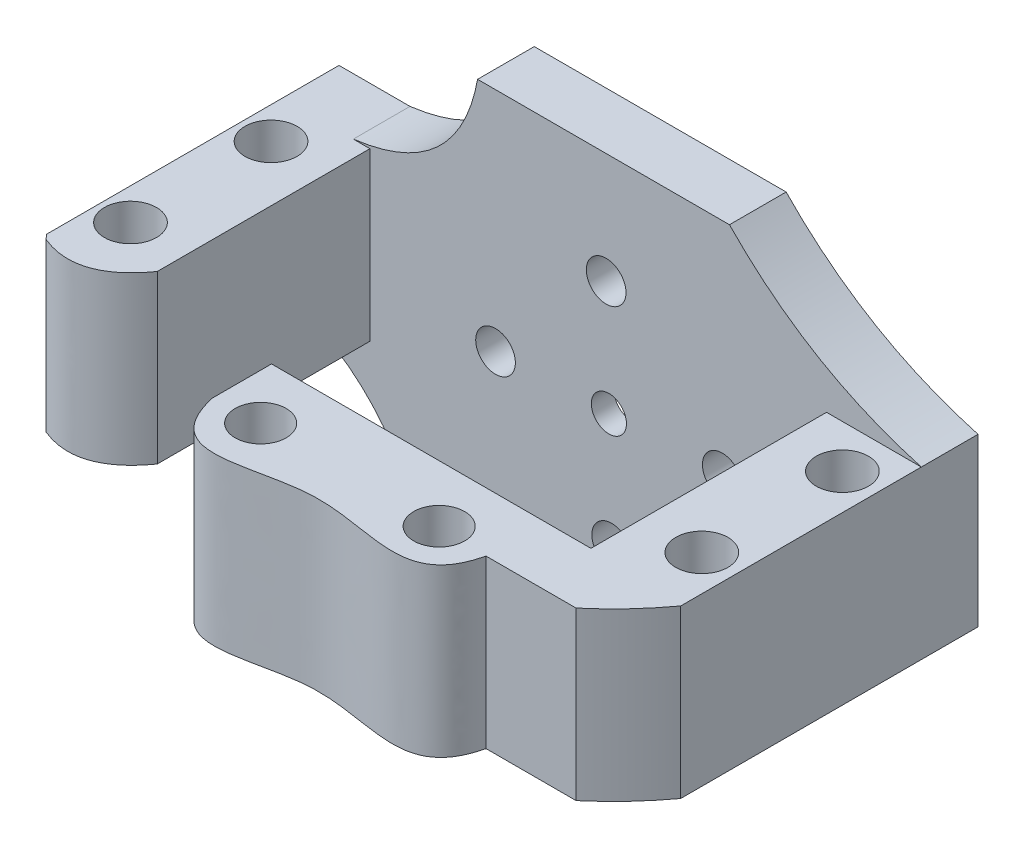
from build123d import *

# Parameters (mm, degrees)
BOSS_EXTRUDE1_DEPTH      = 2
BOSS_EXTRUDE1_DEPTH_BACK = 3
SKETCH1_W                = 56.68892319
SKETCH1_H                = 35.065129922
BOSS_EXTRUDE2_DEPTH      = 26
BOSS_EXTRUDE2_DEPTH_BACK = 5
SKETCH2_W                = 9
SKETCH2_H                = 14.710997498
SKETCH5_R                = 5.097736242
BOSS_EXTRUDE4_DEPTH      = 2
SKETCH6_R                = 1.55
CUT_EXTRUDE2_DEPTH       = 12
SKETCH9_R                = 2.3
CUT_EXTRUDE3_DEPTH       = 50.872623649
SKETCH13_W               = 7.608886802
SKETCH13_H               = 17.558293241
CUT_EXTRUDE4_DEPTH       = 54.293517107
CUT_EXTRUDE6_DEPTH       = 50.872623649
CUT_EXTRUDE7_DEPTH       = 10
CUT_EXTRUDE7_DEPTH_BACK  = 50.999496602
SKETCH17_W               = 7.162243751
SKETCH17_H               = 32.627999311
SKETCH17_W_2             = 7.157690474
SKETCH17_H_2             = 31.051745439
CUT_EXTRUDE9_DEPTH       = 2.5
SKETCH24_R               = 1.75
CUT_EXTRUDE10_DEPTH      = 52.478229038
CUT_EXTRUDE12_DEPTH      = 10
BOSS_EXTRUDE5_DEPTH      = 40.277622666
BOSS_EXTRUDE6_DEPTH      = 14.710997498
SKETCH30_R               = 2.25
CUT_EXTRUDE13_DEPTH      = 52.916046991
CUT_EXTRUDE14_DEPTH      = 52.916046991


with BuildPart() as part:
    # Sketch1 → Boss-Extrude1 (new, two sides: drawn at the far end of the back side and taken through both)
    with BuildSketch(Plane.XY.offset(-BOSS_EXTRUDE1_DEPTH_BACK)):
        with Locations((4.039813673, 10.556877227)):
            Rectangle(SKETCH1_W, SKETCH1_H)
        Polygon((1.923198111, 7.878945264), (2.078602096, 7.815714119), (1.958456546, 7.698608939), (2.117524193, 7.645260463), (2.004968818, 7.520842362), (2.16707236, 7.477587097), (2.062551364, 7.346347096), (2.227051052, 7.313355751), (2.130976932, 7.175811795), (2.297223562, 7.153214572), (2.209975479, 7.009909484), (2.37731295, 6.997795563), (2.299235232, 6.849294902), (2.46700314, 6.847712092), (2.398403924, 6.694601923), (2.565940166, 6.70355647), (2.507090183, 6.546441049), (2.67373357, 6.565897614), (2.624865072, 6.405397003), (2.789957938, 6.4352788), (2.751263788, 6.272026422), (2.914154587, 6.312215521), (2.885787493, 6.146855658), (3.04583337, 6.197193451), (3.027905283, 6.030378703), (3.184474611, 6.09066653), (3.177056286, 5.923055239), (3.329531155, 5.993055171), (3.332651868, 5.825308823), (3.480430532, 5.904744602), (3.494077967, 5.737525214), (3.636577209, 5.826083344), (3.660697507, 5.660050854), (3.797354948, 5.757381836), (3.831852916, 5.5931915), (3.962129232, 5.698911213), (4.006868723, 5.537211015), (4.130249772, 5.650902232), (4.185054219, 5.492330327), (4.301053074, 5.613544361), (4.36570619, 5.458726562), (4.473865055, 5.586985036), (4.548111682, 5.436532337), (4.648003705, 5.571329073), (4.731550826, 5.425835242), (4.822781777, 5.56663826), (4.915299671, 5.426677496), (4.997509504, 5.57293111), (5.098633044, 5.439055772), (5.171497314, 5.590182786), (5.280827412, 5.462921221), (5.344058557, 5.618325206), (5.461163737, 5.498179655), (5.514512213, 5.657247303), (5.638930314, 5.544691927), (5.682185579, 5.706795469), (5.81342558, 5.602274473), (5.846416925, 5.766774162), (5.983960881, 5.670700042), (6.006558104, 5.836946671), (6.149863192, 5.749698588), (6.161977113, 5.917036059), (6.310477774, 5.838958341), (6.312060584, 6.00672625), (6.465170753, 5.938127034), (6.456216206, 6.105663276), (6.613331627, 6.046813292), (6.593875062, 6.213456679), (6.754375673, 6.164588181), (6.724493876, 6.329681047), (6.887746254, 6.290986897), (6.847557155, 6.453877697), (7.012917018, 6.425510602), (6.962579225, 6.58555648), (7.129393973, 6.567628393), (7.069106146, 6.72419772), (7.236717437, 6.716779395), (7.166717505, 6.869254264), (7.334463853, 6.872374978), (7.255028074, 7.020153641), (7.422247462, 7.033801076), (7.333689332, 7.176300318), (7.499721822, 7.200420616), (7.40239084, 7.337078057), (7.566581176, 7.371576025), (7.460861463, 7.501852341), (7.622561661, 7.546591832), (7.508870444, 7.669972882), (7.667442349, 7.724777329), (7.546228315, 7.840776184), (7.701046114, 7.905429299), (7.57278764, 8.013588164), (7.723240339, 8.087834791), (7.588443603, 8.187726814), (7.733937434, 8.271273935), (7.593134416, 8.362504887), (7.733095181, 8.45502278), (7.586841566, 8.537232613), (7.720716904, 8.638356153), (7.56958989, 8.711220423), (7.696851455, 8.820550521), (7.54144747, 8.883781667), (7.661593021, 9.000886846), (7.502525373, 9.054235323), (7.615080749, 9.178653423), (7.452977207, 9.221908688), (7.557498203, 9.353148689), (7.392998514, 9.386140034), (7.489072634, 9.52368399), (7.322826005, 9.546281213), (7.410074088, 9.689586302), (7.242736617, 9.701700222), (7.320814335, 9.850200883), (7.153046427, 9.851783693), (7.221645642, 10.004893862), (7.0541094, 9.995939315), (7.112959384, 10.153054737), (6.946315997, 10.133598171), (6.995184495, 10.294098782), (6.830091629, 10.264216985), (6.868785779, 10.427469364), (6.705894979, 10.387280265), (6.734262074, 10.552640127), (6.574216196, 10.502302334), (6.592144283, 10.669117082), (6.435574956, 10.608829255), (6.442993281, 10.776440546), (6.290518412, 10.706440614), (6.287397698, 10.874186963), (6.139619035, 10.794751183), (6.1259716, 10.961970572), (5.983472358, 10.873412442), (5.95935206, 11.039444931), (5.822694619, 10.942113949), (5.788196651, 11.106304285), (5.657920335, 11.000584572), (5.613180844, 11.162284771), (5.489799794, 11.048593553), (5.434995347, 11.207165458), (5.318996492, 11.085951424), (5.254343377, 11.240769224), (5.146184512, 11.11251075), (5.071937885, 11.262963449), (4.972045862, 11.128166712), (4.888498741, 11.273660543), (4.797267789, 11.132857525), (4.704749896, 11.27281829), (4.622540063, 11.126564676), (4.521416523, 11.260440013), (4.448552253, 11.109312999), (4.339222155, 11.236574565), (4.275991009, 11.08117058), (4.15888583, 11.20131613), (4.105537353, 11.042248483), (3.981119253, 11.154803858), (3.937863988, 10.992700316), (3.806623987, 11.097221312), (3.773632642, 10.932721624), (3.636088686, 11.028795744), (3.613491463, 10.862549114), (3.470186374, 10.949797197), (3.458072454, 10.782459726), (3.309571793, 10.860537444), (3.307988983, 10.692769536), (3.154878814, 10.761368752), (3.163833361, 10.59383251), (3.006717939, 10.652682493), (3.026174505, 10.486039107), (2.865673894, 10.534907604), (2.895555691, 10.369814738), (2.732303312, 10.408508888), (2.772492411, 10.245618089), (2.607132549, 10.273985183), (2.657470342, 10.113939306), (2.490655594, 10.131867393), (2.550943421, 9.975298065), (2.38333213, 9.98271639), (2.453332062, 9.830241521), (2.285585713, 9.827120808), (2.365021493, 9.679342144), (2.197802104, 9.665694709), (2.286360234, 9.523195467), (2.120327745, 9.499075169), (2.217658727, 9.362417728), (2.053468391, 9.32791976), (2.159188104, 9.197643444), (1.997487905, 9.152903953), (2.111179123, 9.029522904), (1.952607218, 8.974718457), (2.073821252, 8.858719602), (1.919003452, 8.794066486), (2.047261926, 8.685907621), (1.896809227, 8.611660994), (2.031605964, 8.511768972), (1.886112133, 8.42822185), (2.026915151, 8.336990899), (1.886954386, 8.244473005), (2.033208, 8.162263172), (1.899332663, 8.061139632), (2.050459677, 7.988275362), align=None, mode=Mode.SUBTRACT)
    extrude(amount=BOSS_EXTRUDE1_DEPTH + BOSS_EXTRUDE1_DEPTH_BACK)

    # Sketch2 → Boss-Extrude2 (add, two sides: drawn at the far end of the back side and taken through both)
    with BuildSketch(Plane.XY.offset(2).offset(-BOSS_EXTRUDE2_DEPTH_BACK)):
        Polygon((-16.259715354, 18.039656454), (-16.259715354, 3.328658954), (-25.535246375, 3.328658954), (-25.535246375, 18.039656454), (-18.903134034, 18.039656454), align=None)
        with Locations((28.517907312, 10.684157709)):
            Rectangle(SKETCH2_W, SKETCH2_H)
    extrude(amount=BOSS_EXTRUDE2_DEPTH + BOSS_EXTRUDE2_DEPTH_BACK)

    # Sketch5 → Boss-Extrude4 (add)
    with BuildSketch(Plane.XY.offset(2)):
        with Locations((5.492810563, 7.427794851)):
            Circle(SKETCH5_R)
    extrude(amount=-BOSS_EXTRUDE4_DEPTH)

    # Sketch6 → Cut-Extrude2 (cut)
    with BuildSketch(Plane(origin=(0, 0, -3), x_dir=(-1, 0, 0), z_dir=(0, 0, -1))):
        with Locations(Location((-4.82042515, 8.33646598, 0), (0, 0, 180))):
            Circle(SKETCH6_R)
    extrude(amount=-CUT_EXTRUDE2_DEPTH, mode=Mode.SUBTRACT)

    # Sketch9 → Cut-Extrude3 (cut, through all)
    with BuildSketch(Plane.XZ.offset(-3.328658954)):
        with Locations(Location((-21.182092688, 18.2, 0), (0, 0, 270))):
            Circle(SKETCH9_R)
        with Locations(Location((-21.182092688, 5.8, 0), (0, 0, 270))):
            Circle(SKETCH9_R)
        with Locations(Location((29.217907312, 5.8, 0), (0, 0, 270))):
            Circle(SKETCH9_R)
        with Locations(Location((29.217907312, 18.2, 0), (0, 0, 270))):
            Circle(SKETCH9_R)
    extrude(amount=-CUT_EXTRUDE3_DEPTH, mode=Mode.SUBTRACT)

    # Sketch13 → Cut-Extrude4 (cut, through all)
    with BuildSketch(Plane.XY.offset(28)):
        with Locations((-21.527123777, 26.818803075)):
            Rectangle(SKETCH13_W, SKETCH13_H)
    extrude(amount=-CUT_EXTRUDE4_DEPTH, mode=Mode.SUBTRACT)

    # Sketch16 → Cut-Extrude6 (cut, through all)
    with BuildSketch(Plane.XZ.offset(-3.328658954)):
        with BuildLine():
            Line((-26.354419383, 19.379902699), (-27.787251442, 28.497924892))
            Line((-27.787251442, 28.497924892), (-17.849791636, 28))
            add(Edge.make_bspline(
                [(-17.849791636, 28), (-23.252097772, 24.763584197), (-26.354419383, 19.379902699)],
                knots=[0, 0, 0, 1, 1, 1], degree=2))
        make_face()
        with BuildLine():
            Line((34.733992228, 19.379902699), (34.733992228, 30.066085519))
            Line((34.733992228, 30.066085519), (27.925980754, 28))
            add(Edge.make_bspline(
                [(27.925980754, 28), (32.208635207, 24.359976547), (34.733992228, 19.379902699)],
                knots=[0, 0, 0, 1, 1, 1], degree=2))
        make_face()
    extrude(amount=-CUT_EXTRUDE6_DEPTH, mode=Mode.SUBTRACT)

    # Sketch17 → Cut-Extrude7 (cut, two sides: drawn at the far end of the back side and taken through both)
    with BuildSketch(Plane(origin=(0, 18.039656458, 0), x_dir=(1, 0, 0), z_dir=(0, 1, 0)).offset(-CUT_EXTRUDE7_DEPTH_BACK)):
        with Locations((35.960804817, -11.620676388)):
            Rectangle(SKETCH17_W, SKETCH17_H)
        with Locations((-27.56606756, -9.811105837)):
            Rectangle(SKETCH17_W_2, SKETCH17_H_2)
    extrude(amount=CUT_EXTRUDE7_DEPTH + CUT_EXTRUDE7_DEPTH_BACK, mode=Mode.SUBTRACT)

    # Sketch23 → Cut-Extrude9 (cut)
    with BuildSketch(Plane(origin=(0, 0, -3), x_dir=(-1, 0, 0), z_dir=(0, 0, -1))):
        with BuildLine():
            ThreePointArc((0.924137497, 12.33646598), (0.129322319, 13.286213449), (-0.82042515, 14.081028627))
            add(Edge.make_bspline(
                [(-4.82042515, 26.33646598), (-1.27643089, 26.709624798), (-1.432488287, 20.670941026), (-0.502680663, 16.534821019), (-0.82042515, 14.081028627)],
                knots=[0, 0, 0, 0, 0.519506154, 1, 1, 1, 1], degree=3))
            add(Edge.make_bspline(
                [(-4.82042515, 26.33646598), (-8.364419409, 26.709624798), (-8.208362012, 20.670941026), (-9.138169637, 16.534821019), (-8.82042515, 14.081028627)],
                knots=[0, 0, 0, 0, 0.519506154, 1, 1, 1, 1], degree=3))
            ThreePointArc((-8.82042515, 14.081028627), (-9.770172618, 13.286213449), (-10.564987796, 12.33646598))
            add(Edge.make_bspline(
                [(-22.82042515, 8.33646598), (-23.193583967, 11.88046024), (-17.154900196, 11.724402843), (-13.018780189, 12.654210467), (-10.564987796, 12.33646598)],
                knots=[0, 0, 0, 0, 0.519506154, 1, 1, 1, 1], degree=3))
            add(Edge.make_bspline(
                [(-22.82042515, 8.33646598), (-23.193583967, 4.792471721), (-17.154900196, 4.948529118), (-13.018780189, 4.018721493), (-10.564987796, 4.33646598)],
                knots=[0, 0, 0, 0, 0.519506154, 1, 1, 1, 1], degree=3))
            ThreePointArc((-10.564987796, 4.33646598), (-9.770172618, 3.386718512), (-8.82042515, 2.591903334))
            add(Edge.make_bspline(
                [(-4.82042515, -9.66353402), (-8.364419409, -10.036692837), (-8.208362012, -3.998009066), (-9.138169637, 0.138110942), (-8.82042515, 2.591903334)],
                knots=[0, 0, 0, 0, 0.519506154, 1, 1, 1, 1], degree=3))
            add(Edge.make_bspline(
                [(-4.82042515, -9.66353402), (-1.27643089, -10.036692837), (-1.432488287, -3.998009066), (-0.502680663, 0.138110942), (-0.82042515, 2.591903334)],
                knots=[0, 0, 0, 0, 0.519506154, 1, 1, 1, 1], degree=3))
            ThreePointArc((-0.82042515, 2.591903334), (0.129322319, 3.386718512), (0.924137497, 4.33646598))
            add(Edge.make_bspline(
                [(13.17957485, 8.33646598), (13.552733668, 4.792471721), (7.514049896, 4.948529118), (3.377929889, 4.018721493), (0.924137497, 4.33646598)],
                knots=[0, 0, 0, 0, 0.519506154, 1, 1, 1, 1], degree=3))
            add(Edge.make_bspline(
                [(13.17957485, 8.33646598), (13.552733668, 11.88046024), (7.514049896, 11.724402843), (3.377929889, 12.654210467), (0.924137497, 12.33646598)],
                knots=[0, 0, 0, 0, 0.519506154, 1, 1, 1, 1], degree=3))
        make_face()
    extrude(amount=-CUT_EXTRUDE9_DEPTH, mode=Mode.SUBTRACT)

    # Sketch24 → Cut-Extrude10 (cut, through all)
    with BuildSketch(Plane(origin=(0, 0, -0.5), x_dir=(-1, 0, 0), z_dir=(0, 0, -1))):
        with Locations((5.17957485, 8.09434948)):
            Circle(SKETCH24_R)
        with Locations((-5.06254165, -1.66353402)):
            Circle(SKETCH24_R)
        with Locations((-14.82042515, 8.578582481)):
            Circle(SKETCH24_R)
        with Locations((-4.578308649, 18.33646598)):
            Circle(SKETCH24_R)
    extrude(amount=-CUT_EXTRUDE10_DEPTH, mode=Mode.SUBTRACT)

    # Sketch27 → Cut-Extrude12 (cut)
    with BuildSketch(Plane(origin=(0, 0, -3), x_dir=(-1, 0, 0), z_dir=(0, 0, -1))):
        with BuildLine():
            Line((23.987222323, -6.975687734), (23.987222323, 3.328658954))
            add(Edge.make_bspline(
                [(23.987222323, 3.328658954), (15.98825926, 1.074909733), (12.528917408, -6.975687734)],
                knots=[0, 0, 0, 1, 1, 1], degree=2))
            Line((12.528917408, -6.975687734), (23.987222323, -6.975687734))
        make_face()
        with BuildLine():
            add(Edge.make_bspline(
                [(-32.379682941, 3.328658954), (-22.329846006, 1.10880055), (-16.985720236, -6.975687734)],
                knots=[0, 0, 0, 1, 1, 1], degree=2))
            Line((-32.379682941, 3.328658954), (-32.379682941, -6.975687734))
            Line((-32.379682941, -6.975687734), (-16.985720236, -6.975687734))
        make_face()
        with BuildLine():
            add(Edge.make_bspline(
                [(-32.379682941, 18.039656458), (-22.497838784, 20.806158325), (-15.456251992, 28.089442188)],
                knots=[0, 0, 0, 1, 1, 1], degree=2))
            Line((-15.456251992, 28.089442188), (-32.384275268, 28.089442188))
            Line((-32.384275268, 28.089442188), (-32.384275268, 28.039656458))
            Line((-32.384275268, 28.039656458), (-32.379682941, 28.039656458))
            Line((-32.379682941, 28.039656458), (-32.379682941, 18.039656458))
        make_face()
        with BuildLine():
            add(Edge.make_bspline(
                [(17.722680376, 18.039656454), (8.395255048, 19.227401982), (6.762541666, 28.089442188)],
                knots=[0, 0, 0, 1, 1, 1], degree=2))
            Line((17.722680376, 18.039656454), (17.722680376, 28.089442188))
            Line((17.722680376, 28.089442188), (6.762541666, 28.089442188))
        make_face()
    extrude(amount=-CUT_EXTRUDE12_DEPTH, mode=Mode.SUBTRACT)

    # Sketch28 → Boss-Extrude5 (add)
    with BuildSketch(Plane.ZY.offset(-24.017907312)):
        Polygon((28, 18.039656458), (22.782680935, 18.039656458), (22.782680935, 3.328658954), (28, 3.32865896), align=None)
    extrude(amount=BOSS_EXTRUDE5_DEPTH)

    # Sketch29 → Boss-Extrude6 (add)
    with BuildSketch(Plane.XZ.offset(-3.32865896)):
        with BuildLine():
            Line((-4.156120721, 28), (19.985968923, 28))
            add(Edge.make_bspline(
                [(-4.156120721, 28), (-2.591596523, 34.868829877), (7.621635132, 27.574641456), (18.539811362, 34.133493892), (19.985968923, 28)],
                knots=[0, 0, 0, 0, 0.506238888, 1, 1, 1, 1], degree=3))
        make_face()
    extrude(amount=-BOSS_EXTRUDE6_DEPTH)

    # Sketch30 → Cut-Extrude13 (cut, through all)
    with BuildSketch(Plane.XZ.offset(-3.32865896)):
        with Locations((-0.110241433, 27.78684179)):
            Circle(SKETCH30_R)
        with Locations((15.638405238, 27.78684179)):
            Circle(SKETCH30_R)
    extrude(amount=-CUT_EXTRUDE13_DEPTH, mode=Mode.SUBTRACT)

    # Sketch31 → Cut-Extrude14 (cut, through all)
    with BuildSketch(Plane.XZ.offset(-3.32865896)):
        with BuildLine():
            Line((-4.156120721, 28), (-4.156120721, 22.782680935))
            Line((-4.156120721, 22.782680935), (-16.259715354, 20.757674298))
            add(Edge.make_bspline(
                [(-24.853796193, 22.597927725), (-19.720772099, 25.595994901), (-16.259715354, 20.757674298)],
                knots=[0, 0, 0, 1, 1, 1], degree=2))
            Line((-24.853796193, 22.597927725), (-14.738849672, 32.900960573))
            Line((-14.738849672, 32.900960573), (-4.156120721, 28))
        make_face()
    extrude(amount=-CUT_EXTRUDE14_DEPTH, mode=Mode.SUBTRACT)


solid = part.part
